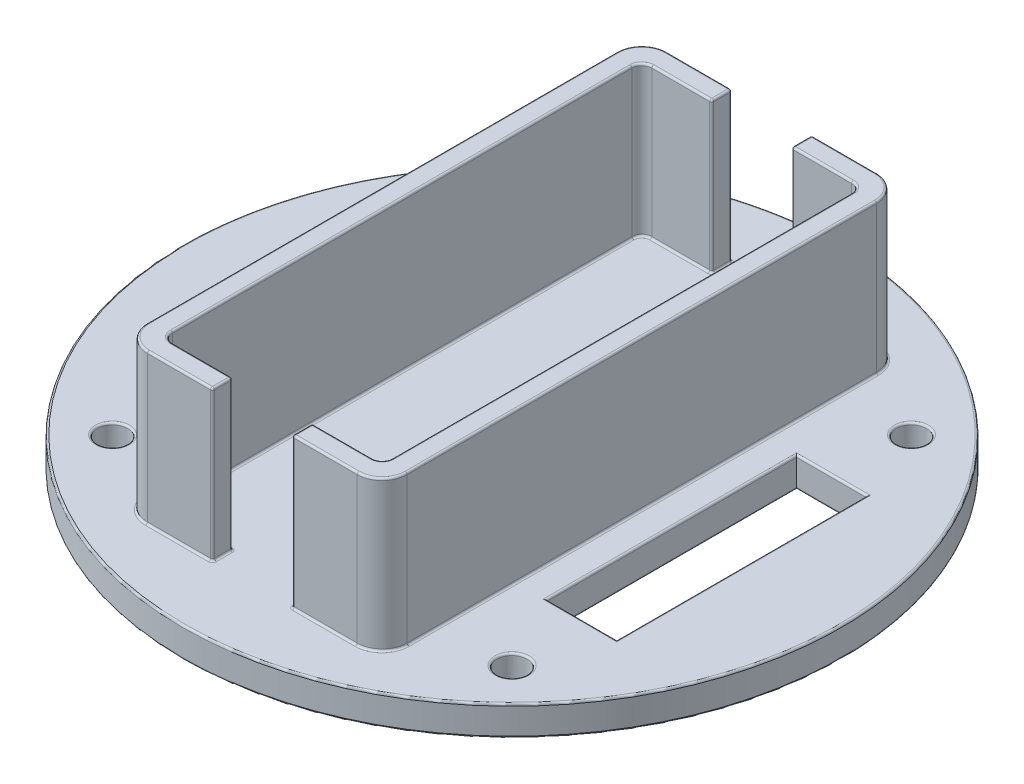
from build123d import *

# Parameters (mm, degrees)
SKETCH1_R           = 33
BOSS_EXTRUDE1_DEPTH = 3
EXTRUDE_THIN1_DEPTH = 15
CUT_EXTRUDE1_REACH  = 51.02
SKETCH3_W           = 7
SKETCH3_H           = 25
CUT_EXTRUDE2_REACH  = 51.02
SKETCH4_R           = 1.5
FILLET2_R           = 1
FILLET3_R           = 2.5
FILLET5_R           = 0.2


with BuildPart() as part:
    # Sketch1 → Boss-Extrude1 (new body)
    with BuildSketch(Plane(origin=(0, 0, 0), x_dir=(1, 0, 0), z_dir=(0, 1, 0))):
        with Locations(Location((0, 0, 0), (0, 0, 270))):
            Circle(SKETCH1_R)
    extrude(amount=BOSS_EXTRUDE1_DEPTH)

    # Sketch2 → Extrude-Thin1 (add)
    with BuildSketch(Plane(origin=(0, 3, 0), x_dir=(1, 0, 0), z_dir=(0, 1, 0))):
        Polygon((-4, 26), (-13, 26), (-13, -26), (-4, -26), (-4, -24), (-11, -24), (-11, 24), (-4, 24), align=None)
        Polygon((4, 24), (11, 24), (11, -24), (4, -24), (4, -26), (13, -26), (13, 26), (4, 26), align=None)
    extrude(amount=EXTRUDE_THIN1_DEPTH)

    # Sketch3 → Cut-Extrude1 (cut, up to next)
    with BuildSketch(Plane(origin=(0, 3, 0), x_dir=(1, 0, 0), z_dir=(0, 1, 0)), mode=Mode.PRIVATE) as cut_extrude1_sk1:
        with Locations((-19.5, 0)):
            Rectangle(SKETCH3_W, SKETCH3_H)
    cut_extrude1_tool1 = extrude(cut_extrude1_sk1.sketch, amount=-CUT_EXTRUDE1_REACH, mode=Mode.PRIVATE) & part.part
    # Sketch3 → Cut-Extrude1 (cut, up to next)
    with BuildSketch(Plane(origin=(0, 3, 0), x_dir=(1, 0, 0), z_dir=(0, 1, 0)), mode=Mode.PRIVATE) as cut_extrude1_sk2:
        with Locations((19.5, 0)):
            Rectangle(SKETCH3_W, SKETCH3_H)
    cut_extrude1_tool2 = extrude(cut_extrude1_sk2.sketch, amount=-CUT_EXTRUDE1_REACH, mode=Mode.PRIVATE) & part.part
    add(cut_extrude1_tool1.solids().sort_by_distance((-19.5, 3, 0))[0], mode=Mode.SUBTRACT)
    add(cut_extrude1_tool2.solids().sort_by_distance((19.5, 3, 0))[0], mode=Mode.SUBTRACT)

    # Sketch4 → Cut-Extrude2 (cut, up to next)
    with BuildSketch(Plane(origin=(0, 3, 0), x_dir=(1, 0, 0), z_dir=(0, 1, 0)), mode=Mode.PRIVATE) as cut_extrude2_sk1:
        with Locations(Location((-20, -20, 0), (0, 0, 270))):
            Circle(SKETCH4_R)
    cut_extrude2_tool1 = extrude(cut_extrude2_sk1.sketch, amount=-CUT_EXTRUDE2_REACH, mode=Mode.PRIVATE) & part.part
    # Sketch4 → Cut-Extrude2 (cut, up to next)
    with BuildSketch(Plane(origin=(0, 3, 0), x_dir=(1, 0, 0), z_dir=(0, 1, 0)), mode=Mode.PRIVATE) as cut_extrude2_sk2:
        with Locations(Location((20, -20, 0), (0, 0, 270))):
            Circle(SKETCH4_R)
    cut_extrude2_tool2 = extrude(cut_extrude2_sk2.sketch, amount=-CUT_EXTRUDE2_REACH, mode=Mode.PRIVATE) & part.part
    # Sketch4 → Cut-Extrude2 (cut, up to next)
    with BuildSketch(Plane(origin=(0, 3, 0), x_dir=(1, 0, 0), z_dir=(0, 1, 0)), mode=Mode.PRIVATE) as cut_extrude2_sk3:
        with Locations(Location((20, 20, 0), (0, 0, 270))):
            Circle(SKETCH4_R)
    cut_extrude2_tool3 = extrude(cut_extrude2_sk3.sketch, amount=-CUT_EXTRUDE2_REACH, mode=Mode.PRIVATE) & part.part
    # Sketch4 → Cut-Extrude2 (cut, up to next)
    with BuildSketch(Plane(origin=(0, 3, 0), x_dir=(1, 0, 0), z_dir=(0, 1, 0)), mode=Mode.PRIVATE) as cut_extrude2_sk4:
        with Locations(Location((-20, 20, 0), (0, 0, 270))):
            Circle(SKETCH4_R)
    cut_extrude2_tool4 = extrude(cut_extrude2_sk4.sketch, amount=-CUT_EXTRUDE2_REACH, mode=Mode.PRIVATE) & part.part
    add(cut_extrude2_tool1.solids().sort_by_distance((-20, 3, 20))[0], mode=Mode.SUBTRACT)
    add(cut_extrude2_tool2.solids().sort_by_distance((20, 3, 20))[0], mode=Mode.SUBTRACT)
    add(cut_extrude2_tool3.solids().sort_by_distance((20, 3, -20))[0], mode=Mode.SUBTRACT)
    add(cut_extrude2_tool4.solids().sort_by_distance((-20, 3, -20))[0], mode=Mode.SUBTRACT)

    # Fillet2
    fillet2_edges = [part.edges().sort_by_distance(p)[0] for p in [
        (-11, 10.5, 24),
        (-11, 10.5, -24),
        (11, 10.5, 24),
        (11, 10.5, -24),
    ]]
    fillet(fillet2_edges, radius=FILLET2_R)

    # Fillet3
    fillet3_edges = [part.edges().sort_by_distance(p)[0] for p in [
        (-13, 10.5, 26),
        (-13, 10.5, -26),
        (13, 10.5, 26),
        (13, 10.5, -26),
    ]]
    fillet(fillet3_edges, radius=FILLET3_R)

    # Fillet5
    fillet5_edges = [part.edges().sort_by_distance(p)[0] for p in [
        (-11, 3, 0),
        (-11, 18, 0),
        (7, 3, 24),
        (11, 3, 0),
        (-7, 3, 24),
        (-10.707106781, 3, -23.707106781),
        (10.707106781, 3, -23.707106781),
        (10.707106781, 3, 23.707106781),
        (-10.707106781, 3, 23.707106781),
        (-7, 18, 24),
        (7, 18, 24),
        (11, 18, 0),
        (-10.707106781, 18, 23.707106781),
        (10.707106781, 18, 23.707106781),
        (10.707106781, 18, -23.707106781),
        (-10.707106781, 18, -23.707106781),
        (13, 3, 0),
        (13, 18, 0),
        (7.25, 18, 26),
        (12.267766953, 18, 25.267766953),
        (12.267766953, 18, -25.267766953),
        (-13, 3, 0),
        (-13, 18, 0),
        (-7.25, 18, 26),
        (-4, 18, 25),
        (-12.267766953, 18, 25.267766953),
        (-12.267766953, 18, -25.267766953),
        (-7.25, 3, 26),
        (-4, 10.5, 26),
        (7.25, 3, 26),
        (12.267766953, 3, -25.267766953),
        (-12.267766953, 3, -25.267766953),
        (-12.267766953, 3, 25.267766953),
        (12.267766953, 3, 25.267766953),
        (-4, 10.5, 24),
        (-7, 18, -24),
        (-4, 18, -25),
        (-4, 10.5, -24),
        (-7.25, 3, -26),
        (-4, 10.5, -26),
        (-7.25, 18, -26),
        (-4, 3, -25),
        (-7, 3, -24),
        (-4, 3, 25),
        (0, 0, -33),
        (4, 18, 25),
        (4, 10.5, 24),
        (4, 10.5, 26),
        (7.25, 18, -26),
        (4, 18, -25),
        (4, 10.5, -26),
        (7, 3, -24),
        (4, 10.5, -24),
        (7, 18, -24),
        (4, 3, -25),
        (7.25, 3, -26),
        (4, 3, 25),
        (0, 3, -33),
        (-23, 3, 0),
        (-19.5, 3, 12.5),
        (-16, 3, 0),
        (-19.5, 3, -12.5),
        (-19.5, 0, 12.5),
        (-23, 0, 0),
        (-19.5, 0, -12.5),
        (-16, 0, 0),
        (19.5, 3, -12.5),
        (16, 3, 0),
        (19.5, 3, 12.5),
        (23, 3, 0),
        (16, 0, 0),
        (19.5, 0, -12.5),
        (23, 0, 0),
        (19.5, 0, 12.5),
        (-20, 3, -21.5),
        (-20, 0, -21.5),
        (20, 3, -21.5),
        (20, 0, -21.5),
        (20, 3, 18.5),
        (20, 0, 18.5),
        (-20, 3, 18.5),
        (-20, 0, 18.5),
    ]]
    fillet(fillet5_edges, radius=FILLET5_R)


solid = part.part
